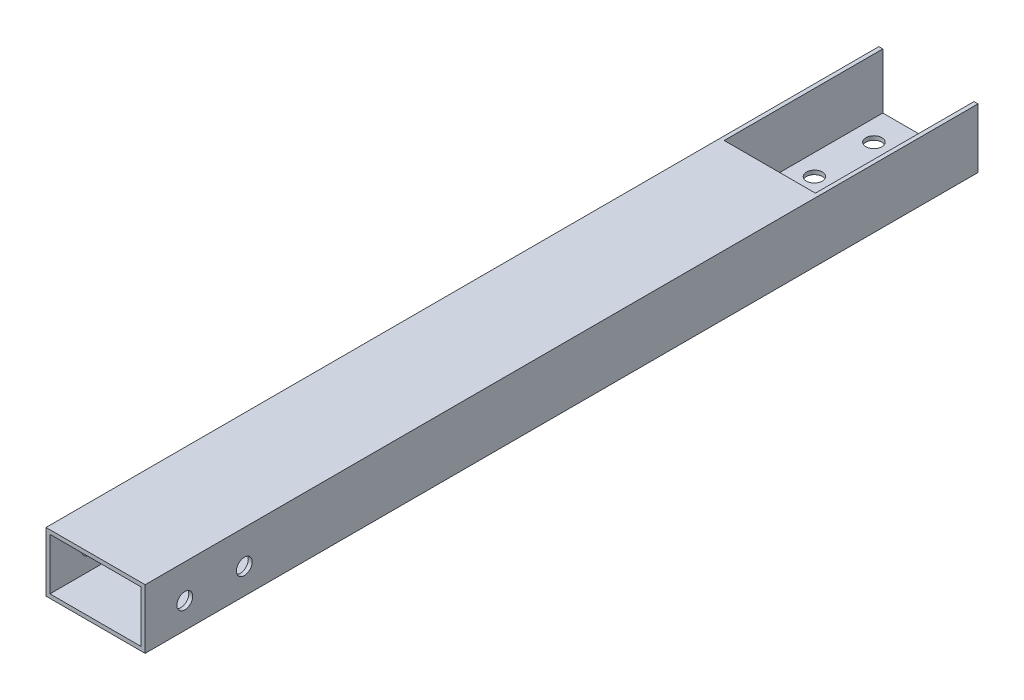
from build123d import *

# Parameters (mm, degrees)
SKETCH1_W           = 50
SKETCH1_H           = 30
SKETCH1_W_2         = 46
SKETCH1_H_2         = 26
BOSS_EXTRUDE1_DEPTH = 420
SKETCH7_R           = 4
CUT_EXTRUDE2_DEPTH  = 424.89149555
SKETCH8_R           = 4
CUT_EXTRUDE3_DEPTH  = 425.028300942
CUT_EXTRUDE4_REACH  = 426.028
SKETCH9_W           = 46
SKETCH9_H           = 80


with BuildPart() as part:
    # Sketch1 → Boss-Extrude1 (new body)
    with BuildSketch(Plane.XY):
        with Locations((25, -15)):
            Rectangle(SKETCH1_W, SKETCH1_H)
        with Locations((25, -15)):
            Rectangle(SKETCH1_W_2, SKETCH1_H_2, mode=Mode.SUBTRACT)
    extrude(amount=BOSS_EXTRUDE1_DEPTH)

    # Sketch7 → Cut-Extrude2 (cut, through all)
    with BuildSketch(Plane(origin=(0, -28, 0), x_dir=(1, 0, 0), z_dir=(0, 1, 0))):
        with Locations(Location((37.5, -45, 0), (0, 0, 270))):
            Circle(SKETCH7_R)
        with Locations(Location((12.5, -45, 0), (0, 0, 270))):
            Circle(SKETCH7_R)
        with Locations(Location((12.5, -15, 0), (0, 0, 270))):
            Circle(SKETCH7_R)
        with Locations(Location((37.5, -15, 0), (0, 0, 270))):
            Circle(SKETCH7_R)
    extrude(amount=-CUT_EXTRUDE2_DEPTH, mode=Mode.SUBTRACT)

    # Sketch8 → Cut-Extrude3 (cut, through all)
    with BuildSketch(Plane(origin=(50, 0, 0), x_dir=(0, 0, -1), z_dir=(1, 0, 0))):
        with Locations(Location((-400, -17, 0), (0, 0, 90))):
            Circle(SKETCH8_R)
        with Locations(Location((-370, -17, 0), (0, 0, 90))):
            Circle(SKETCH8_R)
    extrude(amount=-CUT_EXTRUDE3_DEPTH, mode=Mode.SUBTRACT)

    # Sketch9 → Cut-Extrude4 (cut, up to next)
    with BuildSketch(Plane(origin=(0, 0, 0), x_dir=(1, 0, 0), z_dir=(0, 1, 0)), mode=Mode.PRIVATE) as cut_extrude4_sk1:
        with Locations((25, -40)):
            Rectangle(SKETCH9_W, SKETCH9_H)
    cut_extrude4_tool1 = extrude(cut_extrude4_sk1.sketch, amount=-CUT_EXTRUDE4_REACH, mode=Mode.PRIVATE) & part.part
    add(cut_extrude4_tool1.solids().sort_by_distance((25, 0, 40))[0], mode=Mode.SUBTRACT)


solid = part.part
